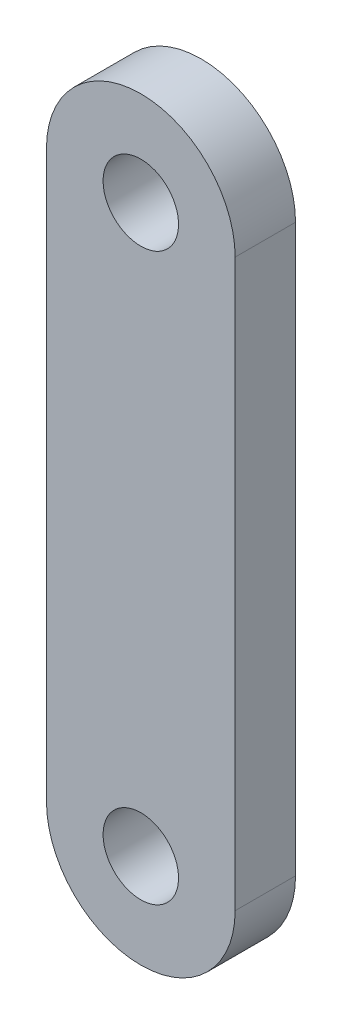
from build123d import *

# Parameters (mm, degrees)
BOSS_EXTRUDE1_DEPTH = 8
SKETCH2_R           = 5
CUT_EXTRUDE1_DEPTH  = 8


with BuildPart() as part:
    # Sketch1 → Boss-Extrude1 (new body)
    with BuildSketch(Plane(origin=(0, 0, 0), x_dir=(0, 1, 0), z_dir=(0, 0, 1))):
        with BuildLine():
            Line((-37.5, 12.5), (37.5, 12.5))
            ThreePointArc((37.5, 12.5), (50, 0), (37.5, -12.5))
            Line((37.5, -12.5), (-37.5, -12.5))
            ThreePointArc((-37.5, -12.5), (-50, 0), (-37.5, 12.5))
        make_face()
    extrude(amount=BOSS_EXTRUDE1_DEPTH)

    # Sketch2 → Cut-Extrude1 (cut)
    with BuildSketch(Plane(origin=(0, 0, 0), x_dir=(1, 0, 0), z_dir=(0, 0, -1))):
        with Locations(Location((0, 37.5, 0), (0, 0, 180))):
            Circle(SKETCH2_R)
        with Locations(Location((0, -37.5, 0), (0, 0, 180))):
            Circle(SKETCH2_R)
    extrude(amount=-CUT_EXTRUDE1_DEPTH, mode=Mode.SUBTRACT)


solid = part.part
